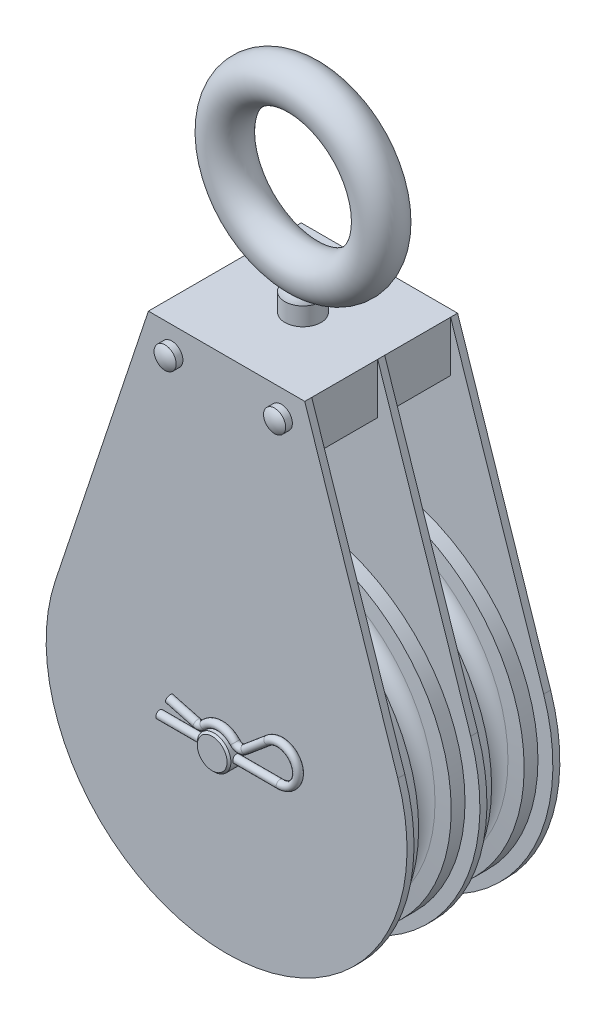
from build123d import *

# Parameters (mm, degrees)
BOSS_EXTRUDE1_DEPTH   = 1.8415
SKETCH5_W             = 41.275
SKETCH5_H             = 13.335
BOSS_EXTRUDE2_DEPTH   = 8.6995
SKETCH10_R            = 5.55625
SKETCH6_R             = 4.445
SKETCH6_R_2           = 2.921
BOSS_EXTRUDE3_DEPTH   = 1.778
DOME1_FACE_RADIUS     = 2.921
DOME1_HEIGHT          = 1.016
DOME3_FACE_RADIUS     = 2.921
DOME3_HEIGHT          = 1.016
SKETCH8_R             = 4.191
BOSS_EXTRUDE4_DEPTH   = 1.778
BOSS_EXTRUDE4_2_DEPTH = 1.778
SKETCH8_R_2           = 6.35
BOSS_EXTRUDE4_3_DEPTH = 1.778
DOME5_FACE_RADIUS     = 4.191
DOME5_HEIGHT          = 2.54
DOME6_FACE_RADIUS     = 4.191
DOME6_HEIGHT          = 2.54
DOME7_FACE_RADIUS     = 6.35
DOME7_HEIGHT          = 3.9624
BOSS_EXTRUDE5_REACH   = 162.38
SKETCH9_R             = 3.57505
SKETCH15_R            = 4.7625
BOSS_EXTRUDE6_DEPTH   = 4.064
FILLET1_R             = 2.032
SKETCH17_R            = 1.016
SKETCH18_R            = 4.445
BOSS_EXTRUDE7_DEPTH   = 2.032
CHAMFER1_SIZE         = 0.508


with BuildPart() as part:
    # Sketch3 → Revolve1 (revolve)
    with BuildSketch(Plane(origin=(0, 0, 0), x_dir=(0, 0, -1), z_dir=(1, 0, 0)), mode=Mode.PRIVATE) as revolve1_sk:
        with BuildLine():
            Line((-7.9375, 44.45), (-7.9375, 0))
            Line((-7.9375, 0), (7.9375, 0))
            Line((7.9375, 0), (7.9375, 44.45))
            Line((7.9375, 44.45), (4.297797433, 44.45))
            Line((4.297797433, 44.45), (3.953647708, 40.516350646))
            ThreePointArc((3.953647708, 40.516350646), (0, 36.8935), (-3.953647708, 40.516350646))
            Line((-3.953647708, 40.516350646), (-4.297797433, 44.45))
            Line((-4.297797433, 44.45), (-7.9375, 44.45))
        make_face()
    revolve(revolve1_sk.sketch.rotate(Axis((0, 0, 7.9375), (0, 0, -1)), 90), axis=Axis((0, 0, 7.9375), (0, 0, -1)))


with BuildPart() as body_2:
    # Sketch4 → Boss-Extrude1 (new body)
    with BuildSketch(Plane.XY.offset(8.6995)):
        with BuildLine():
            Line((-20.6375, 88.9), (20.6375, 88.9))
            Line((20.6375, 88.9), (45.193815989, 15.021971288))
            ThreePointArc((45.193815989, 15.021971288), (0, -47.625), (-45.193815989, 15.021971288))
            Line((-45.193815989, 15.021971288), (-20.6375, 88.9))
        make_face()
    extrude(amount=BOSS_EXTRUDE1_DEPTH)

    # Sketch5 → Boss-Extrude2 (add)
    with BuildSketch(Plane(origin=(0, 0, 8.6995), x_dir=(-1, 0, 0), z_dir=(0, 0, -1))):
        with Locations((0, 82.2325)):
            Rectangle(SKETCH5_W, SKETCH5_H)
    extrude(amount=BOSS_EXTRUDE2_DEPTH)

    # Mirror1: body 2 across plane


with BuildPart() as body_2_1:
    add(body_2.part)
    add(body_2.part.mirror(Plane.XY))


with BuildPart() as body_3:
    # Mirror8: mirrored copy
    add(part.part.mirror(Plane(origin=(0, 0, -9.6266), x_dir=(1, 0, 0), z_dir=(0, 0, -1))))


with BuildPart() as body_4:
    # Mirror8 2: mirrored copy
    add(body_2_1.part.mirror(Plane(origin=(0, 0, -9.6266), x_dir=(1, 0, 0), z_dir=(0, 0, -1))))


with BuildPart() as body_5:
    # Sweep2: sweep along a path in Sketch11
    with BuildLine(Plane.XY.offset(-9.6266)) as sweep2_path:
        ThreePointArc((20.6375, 119.85625), (0, 140.49375), (-20.6375, 119.85625))
    # Sketch10 → Sweep2 (sweep)
    with BuildSketch(Plane(origin=(0, 119.85625, 0), x_dir=(-1, 0, 0), z_dir=(0, 1, 0))):
        with Locations((-20.6375, -9.6266)):
            Circle(SKETCH10_R)
    sweep(path=sweep2_path.line)

    # Mirror7: body 5 across plane


with BuildPart() as body_5_1:
    add(body_5.part)
    add(body_5.part.mirror(Plane(origin=(20.6375, 119.85625, -9.6266), x_dir=(0, 0, 1), z_dir=(0, 1, 0))))

    # Sketch14 → Revolve2 (revolve)
    with BuildSketch(Plane.XY.offset(-9.6266), mode=Mode.PRIVATE) as revolve2_sk:
        with BuildLine():
            Line((4.7625, 88.9), (4.7625, 93.6625))
            ThreePointArc((4.7625, 93.6625), (3.016714146, 96.331608663), (0, 97.366666667))
            Line((0, 97.366666667), (0, 88.9))
            Line((0, 88.9), (4.7625, 88.9))
        make_face()
    revolve(revolve2_sk.sketch.rotate(Axis((0, 53.18125, -9.6266), (0, 1, 0)), 90), axis=Axis((0, 53.18125, -9.6266), (0, 1, 0)))


with BuildPart() as body_2_2:
    add(body_2_1.part)

    # Sketch6 → Boss-Extrude3 (add)
    with BuildSketch(Plane.XY.offset(10.541)):
        Circle(SKETCH6_R)
        with Locations((-14.44625, 82.2325)):
            Circle(SKETCH6_R_2)
        with Locations((14.44625, 82.2325)):
            Circle(SKETCH6_R_2)
    extrude(amount=BOSS_EXTRUDE3_DEPTH)

    # Dome1: a dome of height H over a round flat face of radius A is a cap of a sphere of radius (A * A + H * H) / (2 * H)
    dome1_r = (DOME1_FACE_RADIUS * DOME1_FACE_RADIUS + DOME1_HEIGHT * DOME1_HEIGHT) / (2 * DOME1_HEIGHT)
    dome1_base = Plane((-14.44625, 82.2325, 12.319), z_dir=(0, 0, 1))
    with Locations(dome1_base.offset(DOME1_HEIGHT - dome1_r)):
        dome1_ball = Sphere(dome1_r, mode=Mode.PRIVATE)
    add(split(dome1_ball, bisect_by=dome1_base, keep=Keep.TOP, mode=Mode.PRIVATE))

    # Dome3: a dome of height H over a round flat face of radius A is a cap of a sphere of radius (A * A + H * H) / (2 * H)
    dome3_r = (DOME3_FACE_RADIUS * DOME3_FACE_RADIUS + DOME3_HEIGHT * DOME3_HEIGHT) / (2 * DOME3_HEIGHT)
    dome3_base = Plane((14.44625, 82.2325, 12.319), z_dir=(0, 0, 1))
    with Locations(dome3_base.offset(DOME3_HEIGHT - dome3_r)):
        dome3_ball = Sphere(dome3_r, mode=Mode.PRIVATE)
    add(split(dome3_ball, bisect_by=dome3_base, keep=Keep.TOP, mode=Mode.PRIVATE))


with BuildPart() as body_6:
    # Sketch8 → Boss-Extrude4 (new body)
    with BuildSketch(Plane(origin=(0, 0, -29.7942), x_dir=(-1, 0, 0), z_dir=(0, 0, -1))):
        with Locations((-14.44625, 82.2325)):
            Circle(SKETCH8_R)
    extrude(amount=BOSS_EXTRUDE4_DEPTH)

    # Dome5: a dome of height H over a round flat face of radius A is a cap of a sphere of radius (A * A + H * H) / (2 * H)
    dome5_r = (DOME5_FACE_RADIUS * DOME5_FACE_RADIUS + DOME5_HEIGHT * DOME5_HEIGHT) / (2 * DOME5_HEIGHT)
    dome5_base = Plane((14.44625, 82.2325, -31.5722), z_dir=(0, 0, -1))
    with Locations(dome5_base.offset(DOME5_HEIGHT - dome5_r)):
        dome5_ball = Sphere(dome5_r, mode=Mode.PRIVATE)
    add(split(dome5_ball, bisect_by=dome5_base, keep=Keep.TOP, mode=Mode.PRIVATE))


with BuildPart() as body_7:
    # Sketch8 → Boss-Extrude4 2 (new body)
    with BuildSketch(Plane(origin=(0, 0, -29.7942), x_dir=(-1, 0, 0), z_dir=(0, 0, -1))):
        with Locations((14.44625, 82.2325)):
            Circle(SKETCH8_R)
    extrude(amount=BOSS_EXTRUDE4_2_DEPTH)

    # Dome6: a dome of height H over a round flat face of radius A is a cap of a sphere of radius (A * A + H * H) / (2 * H)
    dome6_r = (DOME6_FACE_RADIUS * DOME6_FACE_RADIUS + DOME6_HEIGHT * DOME6_HEIGHT) / (2 * DOME6_HEIGHT)
    dome6_base = Plane((-14.44625, 82.2325, -31.5722), z_dir=(0, 0, -1))
    with Locations(dome6_base.offset(DOME6_HEIGHT - dome6_r)):
        dome6_ball = Sphere(dome6_r, mode=Mode.PRIVATE)
    add(split(dome6_ball, bisect_by=dome6_base, keep=Keep.TOP, mode=Mode.PRIVATE))


with BuildPart() as body_8:
    # Sketch8 → Boss-Extrude4 3 (new body)
    with BuildSketch(Plane(origin=(0, 0, -29.7942), x_dir=(-1, 0, 0), z_dir=(0, 0, -1))):
        Circle(SKETCH8_R_2)
    extrude(amount=BOSS_EXTRUDE4_3_DEPTH)

    # Dome7: a dome of height H over a round flat face of radius A is a cap of a sphere of radius (A * A + H * H) / (2 * H)
    dome7_r = (DOME7_FACE_RADIUS * DOME7_FACE_RADIUS + DOME7_HEIGHT * DOME7_HEIGHT) / (2 * DOME7_HEIGHT)
    dome7_base = Plane((0, 0, -31.5722), z_dir=(0, 0, -1))
    with Locations(dome7_base.offset(DOME7_HEIGHT - dome7_r)):
        dome7_ball = Sphere(dome7_r, mode=Mode.PRIVATE)
    add(split(dome7_ball, bisect_by=dome7_base, keep=Keep.TOP, mode=Mode.PRIVATE))


with BuildPart() as part_1:
    add(part.part)

    # Boss-Extrude5: up to this face of the body (flat: up to its plane)
    boss_extrude5_end = Plane(body_4.part.faces().sort_by_distance((0, 17.170238389, -29.7942))[0])
    # Sketch9 → Boss-Extrude5 (add, up to the picked face)
    with BuildSketch(Plane.XY.offset(10.541), mode=Mode.PRIVATE) as boss_extrude5_sk1:
        Circle(SKETCH9_R)
    boss_extrude5_tool1 = split(extrude(boss_extrude5_sk1.sketch, amount=-BOSS_EXTRUDE5_REACH, mode=Mode.PRIVATE), bisect_by=boss_extrude5_end, keep=Keep.BOTH, mode=Mode.PRIVATE)

    add(body_2_2.part)  # Boss-Extrude5 merges body 2
    add(boss_extrude5_tool1.solids().sort_by(Axis((0, 0, 10.541), (0, 0, -1)))[0])

    # Combine1: union body 5
    add(body_5_1.part)

    # Sketch15 → Boss-Extrude6 (add)
    with BuildSketch(Plane.XZ.offset(-75.565)):
        with Locations(Location((0, -9.6266, 0), (0, 0, 270))):
            Circle(SKETCH15_R)
    extrude(amount=BOSS_EXTRUDE6_DEPTH)

    # Fillet1
    fillet1_edges = [part_1.edges().sort_by_distance(p)[0] for p in [
        (0, 71.501, -4.8641),
        (0, 71.501, -14.3891),
    ]]
    fillet(fillet1_edges, radius=FILLET1_R)

    # Sweep3: sweep along a path in Sketch16
    with BuildLine(Plane.XY.offset(12.319)) as sweep3_path:
        Line((-15.875, 0), (15.875, 0))
        ThreePointArc((15.875, 0), (20.350286106, 6.391370933), (12.813724009, 8.41078666))
        Line((12.813724009, 8.41078666), (6.7925421, 3.358415141))
        ThreePointArc((6.7925421, 3.358415141), (5.342100682, 2.888147356), (3.972908663, 3.559150567))
        ThreePointArc((3.972908663, 3.559150567), (0, 5.334), (-3.972908663, 3.559150567))
        ThreePointArc((-3.972908663, 3.559150567), (-4.906826117, 2.967423856), (-6.012317977, 2.952256171))
        Line((-6.012317977, 2.952256171), (-13.335, 4.914362905))
    # Sketch17 → Sweep3 (sweep)
    with BuildSketch(Plane(origin=(-15.875, 0, 0), x_dir=(0, 0, -1), z_dir=(1, 0, 0))):
        with Locations((-12.319, 0)):
            Circle(SKETCH17_R)
    sweep(path=sweep3_path.line)

    # Sketch18 → Boss-Extrude7 (add)
    with BuildSketch(Plane.XY.offset(12.319)):
        Circle(SKETCH18_R)
    extrude(amount=BOSS_EXTRUDE7_DEPTH)

    # Chamfer1
    chamfer1_edges = [part_1.edges().sort_by_distance(p)[0] for p in [
        (-4.445, 0, 14.351),
    ]]
    chamfer(chamfer1_edges, length=CHAMFER1_SIZE)

    # Combine2: union body 8, body 7, body 6, body 4, body 3
    add(body_8.part)
    add(body_7.part)
    add(body_6.part)
    add(body_4.part)
    add(body_3.part)


solid = part_1.part
